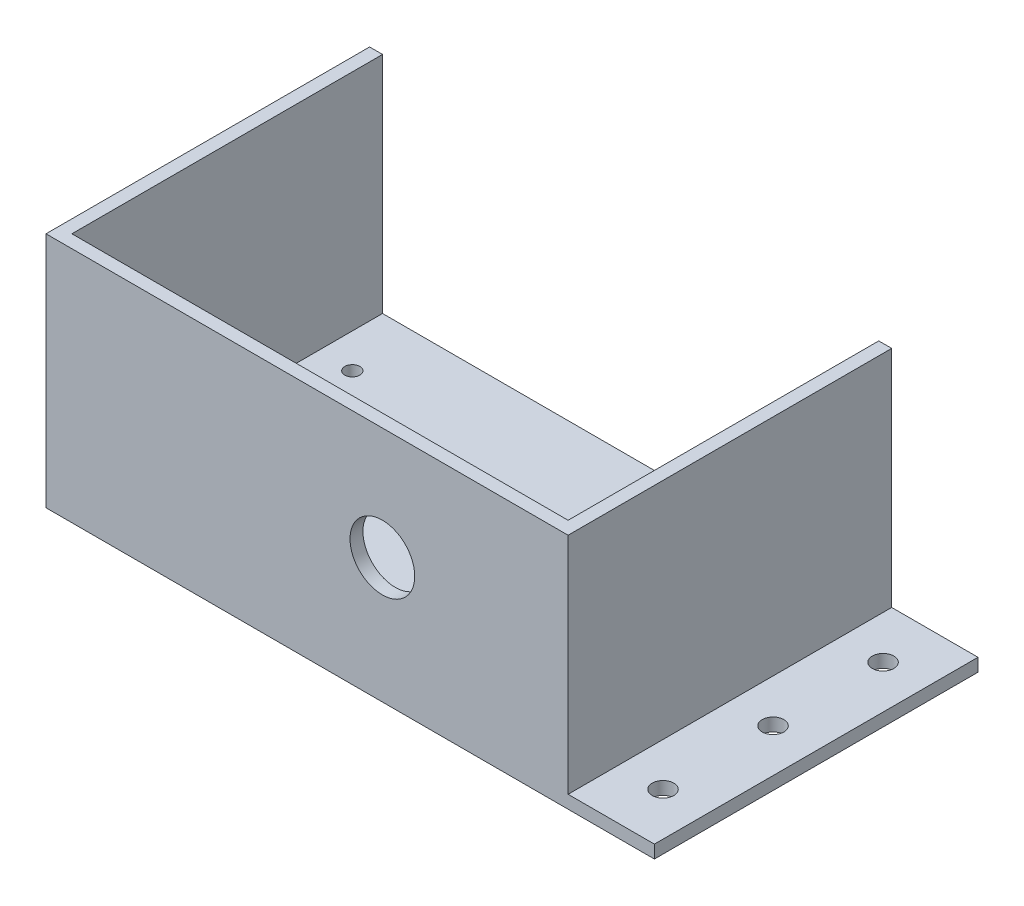
from build123d import *

# Parameters (mm, degrees)
SKETCH1_W           = 121
SKETCH1_H           = 75
BOSS_EXTRUDE1_DEPTH = 58
SKETCH2_W           = 115
SKETCH2_H           = 52
CUT_EXTRUDE1_DEPTH  = 72
SKETCH4_W           = 1.41025641
SKETCH4_H           = 10
BOSS_EXTRUDE2_DEPTH = 1.5
SKETCH5_R           = 1.489811861
SKETCH5_R_2         = 1.5
CUT_EXTRUDE2_DEPTH  = 5
SKETCH6_W           = 75
SKETCH6_H           = 3
BOSS_EXTRUDE3_DEPTH = 20
SKETCH7_R           = 2.5
CUT_EXTRUDE3_DEPTH  = 20
SKETCH8_R           = 7.5
CUT_EXTRUDE4_DEPTH  = 5
SKETCH9_R           = 1.75
CUT_EXTRUDE5_DEPTH  = 5
SKETCH10_W          = 121
SKETCH10_H          = 10.055013608
CUT_EXTRUDE6_DEPTH  = 171.429604315


with BuildPart() as part:
    # Sketch1 → Boss-Extrude1 (new body)
    with BuildSketch(Plane(origin=(0, 0, 0), x_dir=(1, 0, 0), z_dir=(0, 1, 0))):
        with Locations((60.5, 37.5)):
            Rectangle(SKETCH1_W, SKETCH1_H)
    extrude(amount=BOSS_EXTRUDE1_DEPTH)

    # Sketch2 → Cut-Extrude1 (cut)
    with BuildSketch(Plane(origin=(0, 0, -75), x_dir=(-1, 0, 0), z_dir=(0, 0, -1))):
        with Locations((-60.5, 29)):
            Rectangle(SKETCH2_W, SKETCH2_H)
    extrude(amount=-CUT_EXTRUDE1_DEPTH, mode=Mode.SUBTRACT)

    # Sketch4 → Boss-Extrude2 (add)
    # profile 1 of 9: a face of its own
    with BuildSketch(Plane(origin=(0, 58, 0), x_dir=(1, 0, 0), z_dir=(0, 1, 0))):
        with Locations((16.987179487, 60)):
            Rectangle(SKETCH4_W, SKETCH4_H)
    # profile 2 of 9: a face of its own
    with BuildSketch(Plane(origin=(0, 58, 0), x_dir=(1, 0, 0), z_dir=(0, 1, 0))):
        with BuildLine():
            Line((21.58974359, 55), (21.58974359, 65))
            Line((21.58974359, 65), (23.711137821, 65))
            Line((23.711137821, 65), (25.946714744, 57.982772436))
            add(Edge.make_bspline(
                [(25.946714744, 57.982772436), (25.971317363, 57.903279477), (26.018897396, 57.749544721), (26.08945294, 57.527537588), (26.153646657, 57.321231721), (26.211463207, 57.129970438), (26.266025433, 56.954703341), (26.313267723, 56.793992236), (26.358432889, 56.649622979), (26.384901695, 56.557871596), (26.397435897, 56.514423077)],
                knots=[0, 0, 0, 0, 1.300204174, 2.514519184, 3.639827924, 4.676153899, 5.636536826, 6.507959918, 7.293450077, 8, 8, 8, 8], degree=3))
            add(Edge.make_bspline(
                [(26.397435897, 56.514423077), (26.411396089, 56.561850935), (26.441104268, 56.662780451), (26.489265976, 56.821474812), (26.540511404, 56.997087981), (26.601836474, 57.186601452), (26.665760601, 57.392988098), (26.732857292, 57.61607652), (26.810252019, 57.853639448), (26.861684683, 58.018107915), (26.888221154, 58.102964744)],
                knots=[0, 0, 0, 0, 0.713638162, 1.518667645, 2.393860736, 3.354087503, 4.393659122, 5.512594909, 6.716633584, 8, 8, 8, 8], degree=3))
            Line((26.888221154, 58.102964744), (29.101762821, 65))
            Line((29.101762821, 65), (31.205128205, 65))
            Line((31.205128205, 65), (31.205128205, 55))
            Line((31.205128205, 55), (29.794871795, 55))
            Line((29.794871795, 55), (29.794871795, 63.461538462))
            Line((29.794871795, 63.461538462), (27.126602564, 55))
            Line((27.126602564, 55), (25.65224359, 55))
            Line((25.65224359, 55), (23, 63.461538462))
            Line((23, 63.461538462), (23, 55))
            Line((23, 55), (21.58974359, 55))
        make_face()
    # profile 3 of 9: a face of its own
    with BuildSketch(Plane(origin=(0, 58, 0), x_dir=(1, 0, 0), z_dir=(0, 1, 0))):
        Polygon((33.734375, 55), (37.704727564, 65), (39.295272436, 65), (43.265625, 55), (41.769230769, 55), (40.631410256, 58.076923077), (36.368589744, 58.076923077), (35.230769231, 55), align=None)
        with BuildLine():
            Line((36.793269231, 59.230769231), (40.206730769, 59.230769231))
            Line((40.206730769, 59.230769231), (39.235176282, 61.858974359))
            add(Edge.make_bspline(
                [(39.235176282, 61.858974359), (39.197930352, 61.960524623), (39.125107525, 62.159074565), (39.016506752, 62.447550868), (38.917290835, 62.721499806), (38.820001481, 62.976993344), (38.732176644, 63.217742781), (38.65122624, 63.442121964), (38.571166974, 63.648571351), (38.523122282, 63.781958927), (38.5, 63.846153846)],
                knots=[0, 0, 0, 0, 1.225184869, 2.395467751, 3.491410812, 4.525364584, 5.492066482, 6.394148129, 7.227157926, 8, 8, 8, 8], degree=3))
            add(Edge.make_bspline(
                [(38.5, 63.846153846), (38.461751283, 63.687854829), (38.385096138, 63.370604078), (38.224598927, 62.905789169), (38.040995692, 62.445225202), (37.891887987, 62.148440925), (37.816907051, 61.999198718)],
                knots=[0, 0, 0, 0, 0.9891762, 1.982431084, 2.985436691, 4, 4, 4, 4], degree=3))
            Line((37.816907051, 61.999198718), (36.793269231, 59.230769231))
        make_face(mode=Mode.SUBTRACT)
    # profile 4 of 9: a face of its own
    with BuildSketch(Plane(origin=(0, 58, 0), x_dir=(1, 0, 0), z_dir=(0, 1, 0))):
        with BuildLine():
            Line((50.794871795, 58.974358974), (50.794871795, 60.128205128))
            Line((50.794871795, 60.128205128), (54.897435897, 60.128205128))
            Line((54.897435897, 60.128205128), (54.897435897, 56.428285256))
            add(Edge.make_bspline(
                [(54.897435897, 56.428285256), (54.73556896, 56.305002849), (54.416994741, 56.062367775), (53.917376037, 55.745937247), (53.409562732, 55.477566549), (52.894958248, 55.256008429), (52.371793817, 55.085009754), (51.842328107, 54.962612928), (51.305984536, 54.885088148), (50.945369884, 54.876229875), (50.764823718, 54.871794872)],
                knots=[0, 0, 0, 0, 1.08433114, 2.134098231, 3.14842993, 4.143565882, 5.117308249, 6.078377492, 7.037916032, 8, 8, 8, 8], degree=3))
            add(Edge.make_bspline(
                [(50.764823718, 54.871794872), (50.64389522, 54.87365123), (50.40366656, 54.877338949), (50.047995823, 54.908887566), (49.700630006, 54.955764326), (49.362227986, 55.024694072), (49.031595068, 55.112449203), (48.709368093, 55.220898845), (48.395411996, 55.347451318), (48.091476855, 55.49253813), (47.802131001, 55.658770426), (47.528170608, 55.841031042), (47.273051762, 56.0420657), (47.036381783, 56.260230047), (46.819016407, 56.496822026), (46.617735084, 56.748697136), (46.437936839, 57.020470861), (46.275651434, 57.307144136), (46.132352841, 57.606547618), (46.007233593, 57.916126264), (45.903810689, 58.235137402), (45.817554604, 58.562169756), (45.748959138, 58.897100071), (45.701047331, 59.240978048), (45.672844116, 59.593540684), (45.668739297, 59.831680225), (45.666666667, 59.951923077)],
                knots=[0, 0, 0, 0, 1.072770755, 2.131096365, 3.165876834, 4.181397123, 5.193125461, 6.199217581, 7.195986042, 8.195005739, 9.184865672, 10.154356418, 11.112044544, 12.063776475, 13.007136321, 13.960176652, 14.921449994, 15.895149614, 16.88092309, 17.86448639, 18.855604391, 19.854360534, 20.864074582, 21.88711945, 22.933151623, 24, 24, 24, 24], degree=3))
            add(Edge.make_bspline(
                [(45.666666667, 59.951923077), (45.668744997, 60.071498178), (45.672872481, 60.308969721), (45.701316611, 60.662837854), (45.749403968, 61.01051012), (45.815790489, 61.352185335), (45.899570126, 61.687567122), (46.003941343, 62.016720404), (46.128812684, 62.339343656), (46.270237862, 62.654755101), (46.427750978, 62.958441784), (46.60863962, 63.240698377), (46.798821071, 63.508119853), (47.013985843, 63.749080405), (47.239158795, 63.976021204), (47.485357478, 64.178003002), (47.746376315, 64.361105929), (48.023344215, 64.523362037), (48.314631955, 64.664963992), (48.616763548, 64.789673635), (48.930424699, 64.893159395), (49.253817605, 64.980468389), (49.588734219, 65.045340341), (49.934311274, 65.094139841), (50.290939241, 65.12201267), (50.532405627, 65.126123852), (50.654647436, 65.128205128)],
                knots=[0, 0, 0, 0, 1.059979929, 2.105079288, 3.144800512, 4.169876923, 5.189194625, 6.207600986, 7.228841866, 8.254191695, 9.270945245, 10.257936415, 11.22408152, 12.176290364, 13.118065146, 14.055588944, 14.994904974, 15.942096138, 16.897776019, 17.864011786, 18.837383209, 19.823806203, 20.831455606, 21.859450402, 22.916351634, 24, 24, 24, 24], degree=3))
            add(Edge.make_bspline(
                [(50.654647436, 65.128205128), (50.831115136, 65.123959635), (51.175909745, 65.115664501), (51.68071161, 65.051149166), (52.158134205, 64.940754438), (52.536487652, 64.813922736), (52.8206613, 64.690323441), (53.021530624, 64.590430295), (53.21034398, 64.481348357), (53.389274769, 64.366622463), (53.554327508, 64.238724287), (53.707670997, 64.103667865), (53.84970877, 63.959833891), (54.024578118, 63.754555172), (54.224621182, 63.469402744), (54.425338507, 63.082182228), (54.601142318, 62.650536201), (54.688153937, 62.341423111), (54.733173077, 62.181490385)],
                knots=[0, 0, 0, 0, 1.539867261, 3.008697525, 4.432261777, 5.810773619, 6.484177873, 7.135742803, 7.767512201, 8.386601754, 8.989234153, 9.587908519, 10.168964172, 10.7517707, 11.940093668, 13.199243526, 14.550910222, 16, 16, 16, 16], degree=3))
            Line((54.733173077, 62.181490385), (53.443108974, 61.856971154))
            add(Edge.make_bspline(
                [(53.443108974, 61.856971154), (53.405874484, 61.975646851), (53.334562136, 62.202937264), (53.208953288, 62.520609667), (53.062629557, 62.794917237), (52.906173437, 63.03636924), (52.719779789, 63.244075818), (52.503369428, 63.428118249), (52.250462487, 63.587953021), (51.966628117, 63.724803039), (51.658050303, 63.836552659), (51.329620599, 63.916187516), (50.984682955, 63.965713987), (50.748968599, 63.971436756), (50.628605769, 63.974358974)],
                knots=[0, 0, 0, 0, 1.164883671, 2.23101188, 3.193404931, 4.072828119, 4.918883984, 5.797350418, 6.725503451, 7.712871826, 8.743577122, 9.793233972, 10.87315899, 12, 12, 12, 12], degree=3))
            add(Edge.make_bspline(
                [(50.628605769, 63.974358974), (50.486232797, 63.970769984), (50.21058126, 63.963821259), (49.811123469, 63.914008077), (49.441465873, 63.829030609), (49.102847471, 63.707944881), (48.796690432, 63.559104982), (48.518614342, 63.390799982), (48.273333297, 63.198120431), (48.059914961, 62.983524042), (47.874312424, 62.753957932), (47.708805657, 62.514669015), (47.564876039, 62.263726715), (47.488000882, 62.087442093), (47.449519231, 61.999198718)],
                knots=[0, 0, 0, 0, 1.282088634, 2.482280855, 3.618640035, 4.691464057, 5.71354971, 6.679981643, 7.61357903, 8.515091979, 9.399860987, 10.268958177, 11.133486685, 12, 12, 12, 12], degree=3))
            add(Edge.make_bspline(
                [(47.449519231, 61.999198718), (47.392055005, 61.843994267), (47.276389513, 61.5315947), (47.16339573, 61.039243874), (47.090456723, 60.528375998), (47.081479537, 60.180549305), (47.076923077, 60.00400641)],
                knots=[0, 0, 0, 0, 0.971932623, 1.956331326, 2.96271565, 4, 4, 4, 4], degree=3))
            add(Edge.make_bspline(
                [(47.076923077, 60.00400641), (47.077613597, 59.895781102), (47.078966349, 59.683764253), (47.103212206, 59.372463708), (47.134914439, 59.073836949), (47.186365485, 58.789348439), (47.247536072, 58.518150279), (47.323409115, 58.260094134), (47.416152527, 58.016468037), (47.519741217, 57.784886293), (47.638264501, 57.567850479), (47.770253043, 57.365591733), (47.915216958, 57.178217942), (48.072661906, 57.005522406), (48.240252343, 56.844036102), (48.423236889, 56.699921497), (48.619557882, 56.571085484), (48.89498827, 56.417657457), (49.258151731, 56.262770224), (49.70831801, 56.124579887), (50.173570392, 56.042505126), (50.488064727, 56.031293828), (50.646634615, 56.025641026)],
                knots=[0, 0, 0, 0, 1.070760406, 2.097653971, 3.088708526, 4.041547766, 4.95691435, 5.839291284, 6.700934147, 7.534993757, 8.348268852, 9.145600082, 9.922850605, 10.690119832, 11.456705726, 12.223547942, 12.991528328, 13.778467112, 15.341275849, 16.888285822, 18.431055468, 20, 20, 20, 20], degree=3))
            add(Edge.make_bspline(
                [(50.646634615, 56.025641026), (50.785735052, 56.030218875), (51.063294813, 56.039353473), (51.476523468, 56.102740525), (51.883255685, 56.210373903), (52.27650153, 56.355690977), (52.644357284, 56.52213959), (52.96997267, 56.700489064), (53.252725699, 56.878452619), (53.411773916, 57.014721263), (53.487179487, 57.079326923)],
                knots=[0, 0, 0, 0, 1.08078364, 2.156585965, 3.240205791, 4.344938036, 5.41078367, 6.374425311, 7.229306744, 8, 8, 8, 8], degree=3))
            Line((53.487179487, 57.079326923), (53.487179487, 58.974358974))
            Line((53.487179487, 58.974358974), (50.794871795, 58.974358974))
        make_face()
    # profile 5 of 9: a face of its own
    with BuildSketch(Plane(origin=(0, 58, 0), x_dir=(1, 0, 0), z_dir=(0, 1, 0))):
        with Locations((59.628205128, 60)):
            Rectangle(SKETCH4_W, SKETCH4_H)
    # profile 6 of 9: a face of its own
    with BuildSketch(Plane(origin=(0, 58, 0), x_dir=(1, 0, 0), z_dir=(0, 1, 0))):
        Polygon((64.487179487, 55), (64.487179487, 65), (65.977564103, 65), (70.769230769, 57.538060897), (70.769230769, 65), (72.179487179, 65), (72.179487179, 55), (70.689102564, 55), (65.897435897, 62.461939103), (65.897435897, 55), align=None)
    # profile 7 of 9: a face of its own
    with BuildSketch(Plane(origin=(0, 58, 0), x_dir=(1, 0, 0), z_dir=(0, 1, 0))):
        Polygon((76.333333333, 55), (76.333333333, 65), (83.384615385, 65), (83.384615385, 63.846153846), (77.743589744, 63.846153846), (77.743589744, 60.769230769), (83, 60.769230769), (83, 59.615384615), (77.743589744, 59.615384615), (77.743589744, 56.153846154), (83.641025641, 56.153846154), (83.641025641, 55), align=None)
    # profile 8 of 9: a face of its own
    with BuildSketch(Plane(origin=(0, 58, 0), x_dir=(1, 0, 0), z_dir=(0, 1, 0))):
        Polygon((87.41025641, 55), (87.41025641, 65), (94.461538462, 65), (94.461538462, 63.846153846), (88.820512821, 63.846153846), (88.820512821, 60.769230769), (94.076923077, 60.769230769), (94.076923077, 59.615384615), (88.820512821, 59.615384615), (88.820512821, 56.153846154), (94.717948718, 56.153846154), (94.717948718, 55), align=None)
    # profile 9 of 9: a face of its own
    with BuildSketch(Plane(origin=(0, 58, 0), x_dir=(1, 0, 0), z_dir=(0, 1, 0))):
        with BuildLine():
            Line((98.487179487, 55), (98.487179487, 65))
            Line((98.487179487, 65), (102.826121795, 65))
            add(Edge.make_bspline(
                [(102.826121795, 65), (102.9282906, 64.999199465), (103.126026365, 64.997650124), (103.412784052, 64.986682545), (103.680443606, 64.963039323), (103.929497162, 64.937472473), (104.159900472, 64.898230774), (104.371415834, 64.853221431), (104.564369817, 64.799659632), (104.739625043, 64.736399019), (104.902223679, 64.664829112), (105.052940331, 64.576523403), (105.198040099, 64.479759173), (105.332137823, 64.366075645), (105.458770343, 64.241602704), (105.577820293, 64.104649027), (105.687525233, 63.954026134), (105.822833139, 63.738453539), (105.967990935, 63.451356238), (106.088930179, 63.083933901), (106.16690964, 62.699596725), (106.175253665, 62.436946788), (106.179487179, 62.303685897)],
                knots=[0, 0, 0, 0, 1.242255013, 2.404239178, 3.487702428, 4.508875116, 5.447164253, 6.327763259, 7.137389581, 7.87956647, 8.591787438, 9.293660819, 10.000726923, 10.709654955, 11.427269343, 12.158170644, 12.913245971, 13.690346794, 15.251572448, 16.809945773, 18.381459854, 20, 20, 20, 20], degree=3))
            add(Edge.make_bspline(
                [(106.179487179, 62.303685897), (106.177530353, 62.21814429), (106.173665487, 62.04919375), (106.144060224, 61.800791233), (106.090491892, 61.563452617), (106.021801064, 61.335099332), (105.927784275, 61.118966781), (105.818869907, 60.910640388), (105.683940489, 60.715843438), (105.532872085, 60.529388798), (105.359637137, 60.355269829), (105.162711701, 60.199768316), (104.944047853, 60.059894394), (104.702615774, 59.939507239), (104.44119459, 59.829467663), (104.156504185, 59.740858495), (103.849693543, 59.668502315), (103.636998145, 59.63346466), (103.52724359, 59.615384615)],
                knots=[0, 0, 0, 0, 0.982609109, 1.940720374, 2.867584677, 3.775009516, 4.675469332, 5.571146231, 6.471115823, 7.392408543, 8.32534739, 9.286126426, 10.269214477, 11.301811357, 12.381622301, 13.524260118, 14.722474812, 16, 16, 16, 16], degree=3))
            add(Edge.make_bspline(
                [(103.52724359, 59.615384615), (103.607752714, 59.574713182), (103.760642439, 59.497476665), (103.972320158, 59.376370478), (104.151752032, 59.252629797), (104.25570601, 59.164126826), (104.304487179, 59.122596154)],
                knots=[0, 0, 0, 0, 1.172304973, 2.226249348, 3.167654437, 4, 4, 4, 4], degree=3))
            add(Edge.make_bspline(
                [(104.304487179, 59.122596154), (104.398954671, 59.029990406), (104.59299761, 58.83977162), (104.860397207, 58.515773306), (105.119650301, 58.155113465), (105.277166103, 57.894463376), (105.358173077, 57.760416667)],
                knots=[0, 0, 0, 0, 0.918110279, 1.885863737, 2.912745394, 4, 4, 4, 4], degree=3))
            Line((105.358173077, 57.760416667), (106.998798077, 55))
            Line((106.998798077, 55), (105.382211538, 55))
            Line((105.382211538, 55), (104.136217949, 57.111378205))
            add(Edge.make_bspline(
                [(104.136217949, 57.111378205), (104.091418278, 57.185458447), (104.004603872, 57.329013793), (103.879203572, 57.538669464), (103.756252701, 57.731690915), (103.642217872, 57.913594803), (103.532471359, 58.081078753), (103.428073571, 58.234724571), (103.331897581, 58.376547891), (103.212771184, 58.541667143), (103.074127843, 58.724373128), (102.912340577, 58.912525791), (102.758271131, 59.062537403), (102.568531766, 59.209639746), (102.333510857, 59.347229261), (102.133738647, 59.410447864), (102.036858974, 59.441105769)],
                knots=[0, 0, 0, 0, 1.130940588, 2.191577161, 3.191089816, 4.120344442, 4.99615009, 5.80661983, 6.546979556, 7.234477901, 8.466216387, 9.541989141, 10.473533583, 11.269175393, 12.675684693, 14, 14, 14, 14], degree=3))
            add(Edge.make_bspline(
                [(102.036858974, 59.441105769), (101.996211854, 59.448435826), (101.90341326, 59.465170567), (101.74584148, 59.476100052), (101.554923936, 59.487700239), (101.416562739, 59.487362249), (101.341746795, 59.487179487)],
                knots=[0, 0, 0, 0, 0.709978628, 1.620902492, 2.713552433, 4, 4, 4, 4], degree=3))
            Line((101.341746795, 59.487179487), (99.897435897, 59.487179487))
            Line((99.897435897, 59.487179487), (99.897435897, 55))
            Line((99.897435897, 55), (98.487179487, 55))
        make_face()
        with BuildLine():
            Line((99.897435897, 60.641025641), (102.575721154, 60.641025641))
            add(Edge.make_bspline(
                [(102.575721154, 60.641025641), (102.710020522, 60.643126882), (102.961080593, 60.647054955), (103.312148386, 60.680596569), (103.611336258, 60.733895618), (103.864558726, 60.811638523), (104.07730557, 60.919571492), (104.262335542, 61.051107984), (104.416097778, 61.215871133), (104.544012075, 61.401771268), (104.643442482, 61.606345087), (104.715166835, 61.82121989), (104.762111672, 62.044589794), (104.766836719, 62.196612258), (104.769230769, 62.273637821)],
                knots=[0, 0, 0, 0, 1.546323217, 2.890706218, 4.056530419, 5.041445823, 5.928701482, 6.793137403, 7.641659452, 8.509781392, 9.383301667, 10.251423607, 11.114044887, 12, 12, 12, 12], degree=3))
            add(Edge.make_bspline(
                [(104.769230769, 62.273637821), (104.767369495, 62.329769277), (104.763723806, 62.43971431), (104.744611897, 62.601083093), (104.707453809, 62.754420737), (104.658386644, 62.9005378), (104.592822956, 63.03836408), (104.514935969, 63.168967578), (104.421992748, 63.291624437), (104.315531637, 63.406708289), (104.193294934, 63.511423347), (104.053671883, 63.601769729), (103.897763681, 63.678544664), (103.725389111, 63.739478385), (103.537091185, 63.788215443), (103.331797963, 63.820638635), (103.110448296, 63.844099949), (102.957065813, 63.845456423), (102.878205128, 63.846153846)],
                knots=[0, 0, 0, 0, 0.965208469, 1.890559848, 2.786986821, 3.67262109, 4.535197034, 5.405224191, 6.282113641, 7.175449223, 8.095446547, 9.040936516, 10.026471658, 11.075712529, 12.17809725, 13.364958037, 14.645208957, 16, 16, 16, 16], degree=3))
            Line((102.878205128, 63.846153846), (99.897435897, 63.846153846))
            Line((99.897435897, 63.846153846), (99.897435897, 60.641025641))
        make_face(mode=Mode.SUBTRACT)
    extrude(amount=BOSS_EXTRUDE2_DEPTH)

    # Sketch5 → Cut-Extrude2 (cut)
    with BuildSketch(Plane(origin=(0, 58, 0), x_dir=(-1, 0, 0), z_dir=(0, 1, 0))):
        with Locations(Location((-60.478143675, -46.04301681, 0), (0, 0, 90))):
            Circle(SKETCH5_R)
        with Locations(Location((-60.506522325, -6.250393675, 0), (0, 0, 90))):
            Circle(SKETCH5_R_2)
        Polygon((-84.629004206, -12.253075019), (-42.629004206, -12.253075019), (-36.329004969, -18.153076545), (-36.329004969, -34.153074638), (-42.629004206, -40.05307521), (-84.629004206, -40.05307521), align=None)
    extrude(amount=-CUT_EXTRUDE2_DEPTH, mode=Mode.SUBTRACT)

    # Sketch6 → Boss-Extrude3 (add)
    with BuildSketch(Plane(origin=(121, 0, 0), x_dir=(0, 0, -1), z_dir=(1, 0, 0))):
        with Locations((37.5, 1.5)):
            Rectangle(SKETCH6_W, SKETCH6_H)
    extrude(amount=BOSS_EXTRUDE3_DEPTH)

    # Sketch7 → Cut-Extrude3 (cut)
    with BuildSketch(Plane(origin=(0, 3, 0), x_dir=(1, 0, 0), z_dir=(0, 1, 0))):
        with Locations(Location((131, 63, 0), (0, 0, 270))):
            Circle(SKETCH7_R)
        with Locations(Location((131, 37.5, 0), (0, 0, 270))):
            Circle(SKETCH7_R)
        with Locations(Location((131, 12, 0), (0, 0, 270))):
            Circle(SKETCH7_R)
    extrude(amount=-CUT_EXTRUDE3_DEPTH, mode=Mode.SUBTRACT)

    # Sketch8 → Cut-Extrude4 (cut)
    with BuildSketch(Plane.XY):
        with Locations((77.955583756, 29)):
            Circle(SKETCH8_R)
    extrude(amount=-CUT_EXTRUDE4_DEPTH, mode=Mode.SUBTRACT)

    # Sketch9 → Cut-Extrude5 (cut)
    with BuildSketch(Plane.XZ):
        with Locations(Location((11, -60, 0), (0, 0, 270))):
            Circle(SKETCH9_R)
        with Locations(Location((110, -60, 0), (0, 0, 270))):
            Circle(SKETCH9_R)
    extrude(amount=-CUT_EXTRUDE5_DEPTH, mode=Mode.SUBTRACT)

    # Sketch10 → Cut-Extrude6 (cut, through all)
    with BuildSketch(Plane.XY):
        with Locations((60.5, 60.027506804)):
            Rectangle(SKETCH10_W, SKETCH10_H)
    extrude(amount=-CUT_EXTRUDE6_DEPTH, mode=Mode.SUBTRACT)


solid = part.part
